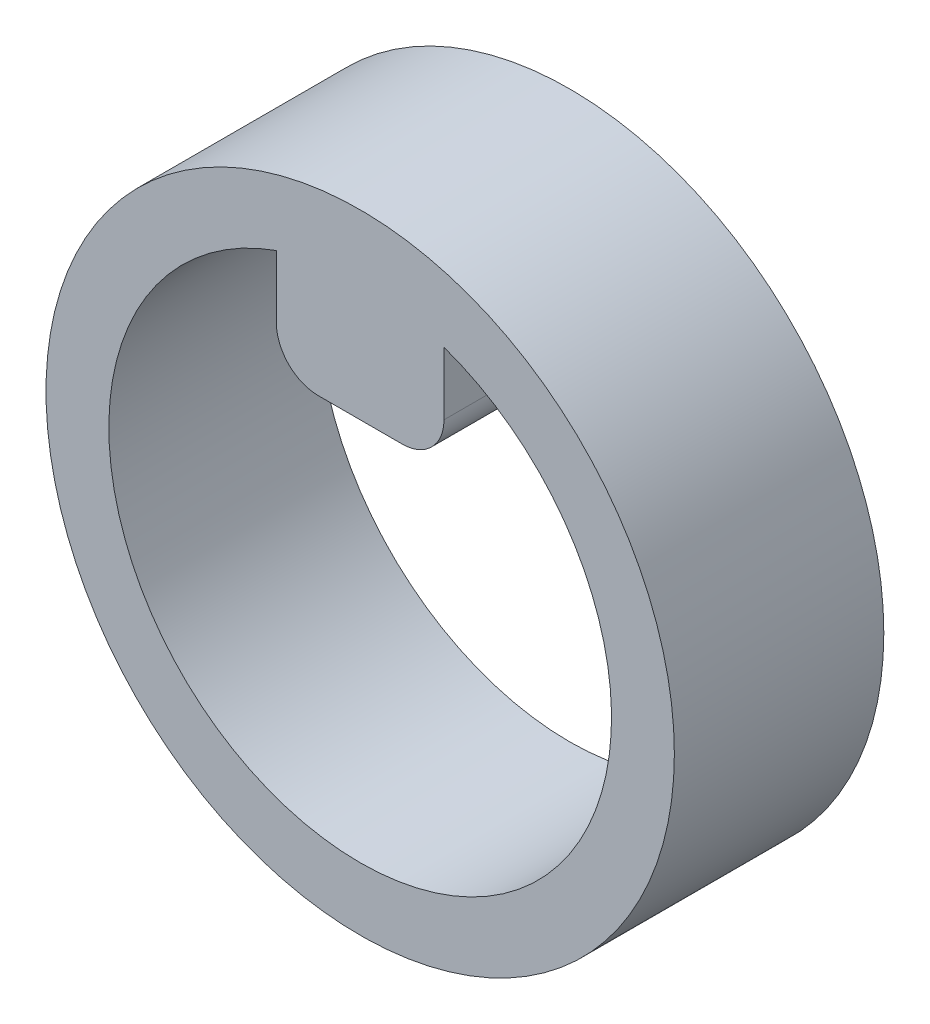
from build123d import *

# Parameters (mm, degrees)
SKETCH2_R           = 7.5
BOSS_EXTRUDE1_DEPTH = 5
FILLET1_R           = 1


with BuildPart() as part:
    # Sketch2 → Boss-Extrude1 (new body)
    with BuildSketch(Plane.XY):
        Circle(SKETCH2_R)
        with BuildLine():
            Line((-2, 3.156854249), (2, 3.156854249))
            Line((2, 3.156854249), (2, 5.656854249))
            ThreePointArc((2, 5.656854249), (0, -6), (-2, 5.656854249))
            Line((-2, 5.656854249), (-2, 3.156854249))
        make_face(mode=Mode.SUBTRACT)
    extrude(amount=BOSS_EXTRUDE1_DEPTH)

    # Fillet1
    fillet1_edges = [part.edges().sort_by_distance(p)[0] for p in [
        (-2, 3.156854249, 2.5),
        (2, 3.156854249, 2.5),
    ]]
    fillet(fillet1_edges, radius=FILLET1_R)


solid = part.part
